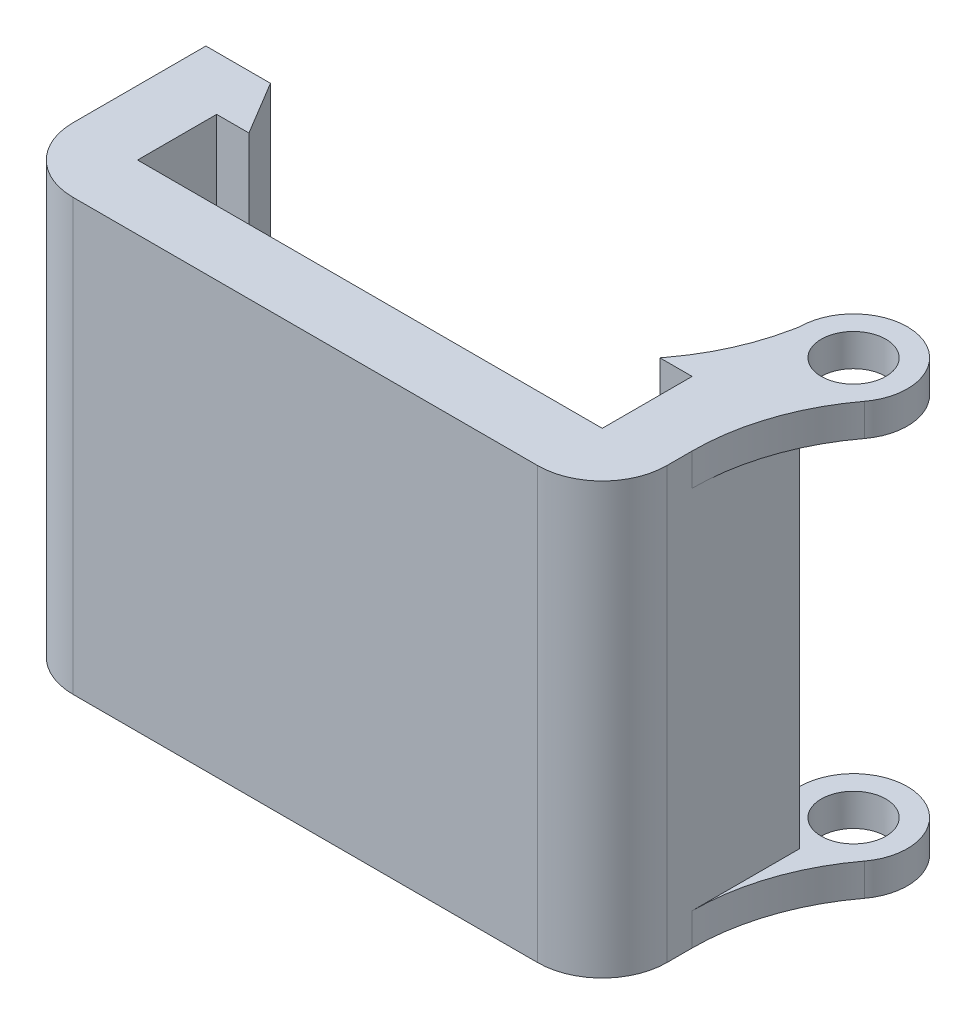
from build123d import *

# Parameters (mm, degrees)
SKETCH1_W           = 27.59
SKETCH1_H           = 20
BOSS_EXTRUDE1_DEPTH = 3
SKETCH2_W           = 3
SKETCH2_H           = 20
BOSS_EXTRUDE2_DEPTH = 6.175
BOSS_EXTRUDE3_DEPTH = 20
BOSS_EXTRUDE5_DEPTH = 1.5
BOSS_EXTRUDE6_START = -1.5
BOSS_EXTRUDE6_DEPTH = 1.5
CUT_EXTRUDE1_START  = -20
SKETCH8_R           = 1.5
CUT_EXTRUDE1_DEPTH  = 20
FILLET1_R           = 10
FILLET2_R           = 10
FILLET4_R           = 3


with BuildPart() as part:
    # Sketch1 → Boss-Extrude1 (new body)
    with BuildSketch(Plane.XY.offset(24.175)):
        with Locations((0, 65.784687602)):
            Rectangle(SKETCH1_W, SKETCH1_H)
    extrude(amount=BOSS_EXTRUDE1_DEPTH)

    # Sketch2 → Boss-Extrude2 (add)
    with BuildSketch(Plane(origin=(0, 0, 24.175), x_dir=(-1, 0, 0), z_dir=(0, 0, -1))):
        with Locations((-12.295, 65.784687602)):
            Rectangle(SKETCH2_W, SKETCH2_H)
        with Locations((12.295, 65.784687602)):
            Rectangle(SKETCH2_W, SKETCH2_H)
    extrude(amount=BOSS_EXTRUDE2_DEPTH)

    # Sketch4 → Boss-Extrude3 (add)
    with BuildSketch(Plane(origin=(0, 75.784687602, 0), x_dir=(1, 0, 0), z_dir=(0, 1, 0))):
        Polygon((-10.795, -20.5), (-10.795, -18), (-9.295, -20.5), align=None)
        Polygon((10.795, -18), (10.795, -20), (9.295, -20), align=None)
    extrude(amount=-BOSS_EXTRUDE3_DEPTH)

    # Sketch6 → Boss-Extrude5 (add)
    with BuildSketch(Plane.XZ.offset(-55.784687602)):
        with BuildLine():
            Line((10.795, 18), (11.295, 15.5))
            ThreePointArc((11.295, 15.5), (15.562766953, 13.732233047), (13.795, 18))
            Line((13.795, 18), (10.795, 18))
        make_face()
    extrude(amount=-BOSS_EXTRUDE5_DEPTH)

    # Sketch7 → Boss-Extrude6 (add)
    with BuildSketch(Plane(origin=(0, 75.784687602, 0), x_dir=(1, 0, 0), z_dir=(0, 1, 0)).offset(BOSS_EXTRUDE6_START)):
        with BuildLine():
            Line((10.795, -18), (11.295, -15.5))
            ThreePointArc((11.295, -15.5), (15.562766953, -13.732233047), (13.795, -18))
            Line((13.795, -18), (10.795, -18))
        make_face()
    extrude(amount=BOSS_EXTRUDE6_DEPTH)

    # Sketch8 → Cut-Extrude1 (cut)
    with BuildSketch(Plane(origin=(0, 75.784687602, 0), x_dir=(1, 0, 0), z_dir=(0, 1, 0)).offset(CUT_EXTRUDE1_START)):
        with Locations(Location((13.795, -15.5, 0), (0, 0, 270))):
            Circle(SKETCH8_R)
    extrude(amount=CUT_EXTRUDE1_DEPTH, mode=Mode.SUBTRACT)

    # Fillet1
    fillet1_edges = [part.edges().sort_by_distance(p)[0] for p in [
        (13.795, 75.034687602, 18),
        (13.795, 56.534687602, 18),
    ]]
    fillet(fillet1_edges, radius=FILLET1_R)

    # Fillet2
    fillet2_edges = [part.edges().sort_by_distance(p)[0] for p in [
        (10.795, 56.534687602, 18),
        (10.795, 75.034687602, 18),
    ]]
    fillet(fillet2_edges, radius=FILLET2_R)

    # Fillet4
    fillet4_edges = [part.edges().sort_by_distance(p)[0] for p in [
        (13.795, 65.784687602, 27.175),
        (-13.795, 65.784687602, 27.175),
    ]]
    fillet(fillet4_edges, radius=FILLET4_R)


solid = part.part
